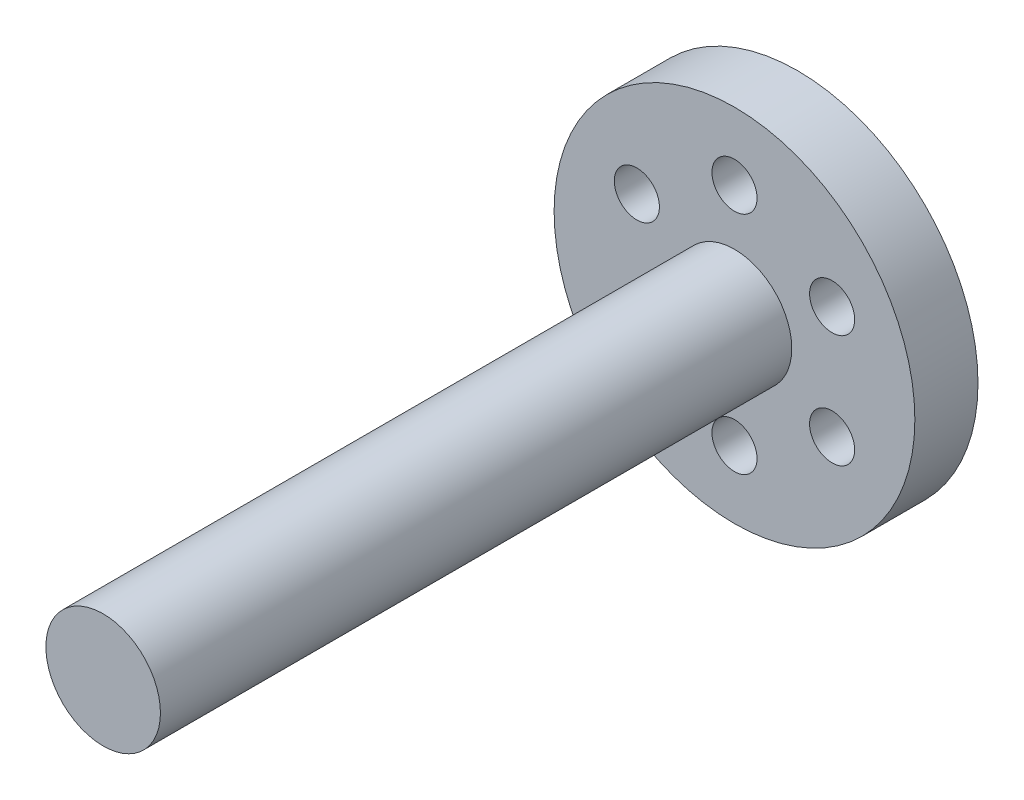
from build123d import *

# Parameters (mm, degrees)
SKETCH1_R                   = 20
BOSS_EXTRUDE1_DEPTH         = 7
TAP_DRILL_FOR_M6X1_0_TAP1_D = 5
CIRPATTERN1_COUNT           = 6
SKETCH3_R                   = 6.35
BOSS_EXTRUDE2_DEPTH         = 70


with BuildPart() as part:
    # Sketch1 → Boss-Extrude1 (new body)
    with BuildSketch(Plane.XY):
        Circle(SKETCH1_R)
    extrude(amount=BOSS_EXTRUDE1_DEPTH)

    # Tap Drill for M6x1.0 Tap1 (through all)
    with Locations(Plane.XY.offset(7)):
        with Locations((0, 12.5)):
            tap_drill_for_m6x1_0_tap1 = Hole(TAP_DRILL_FOR_M6X1_0_TAP1_D / 2)

    # CirPattern1: Tap Drill for M6x1.0 Tap1 ×6 about axis
    cirpattern1_axis = Axis((0, 0, 0), (0, 0, 1))
    for i in range(1, CIRPATTERN1_COUNT):
        add(tap_drill_for_m6x1_0_tap1.rotate(cirpattern1_axis, i * 360 / CIRPATTERN1_COUNT), mode=Mode.SUBTRACT)

    # Sketch3 → Boss-Extrude2 (add)
    with BuildSketch(Plane.XY.offset(7)):
        Circle(SKETCH3_R)
    extrude(amount=BOSS_EXTRUDE2_DEPTH)


solid = part.part
